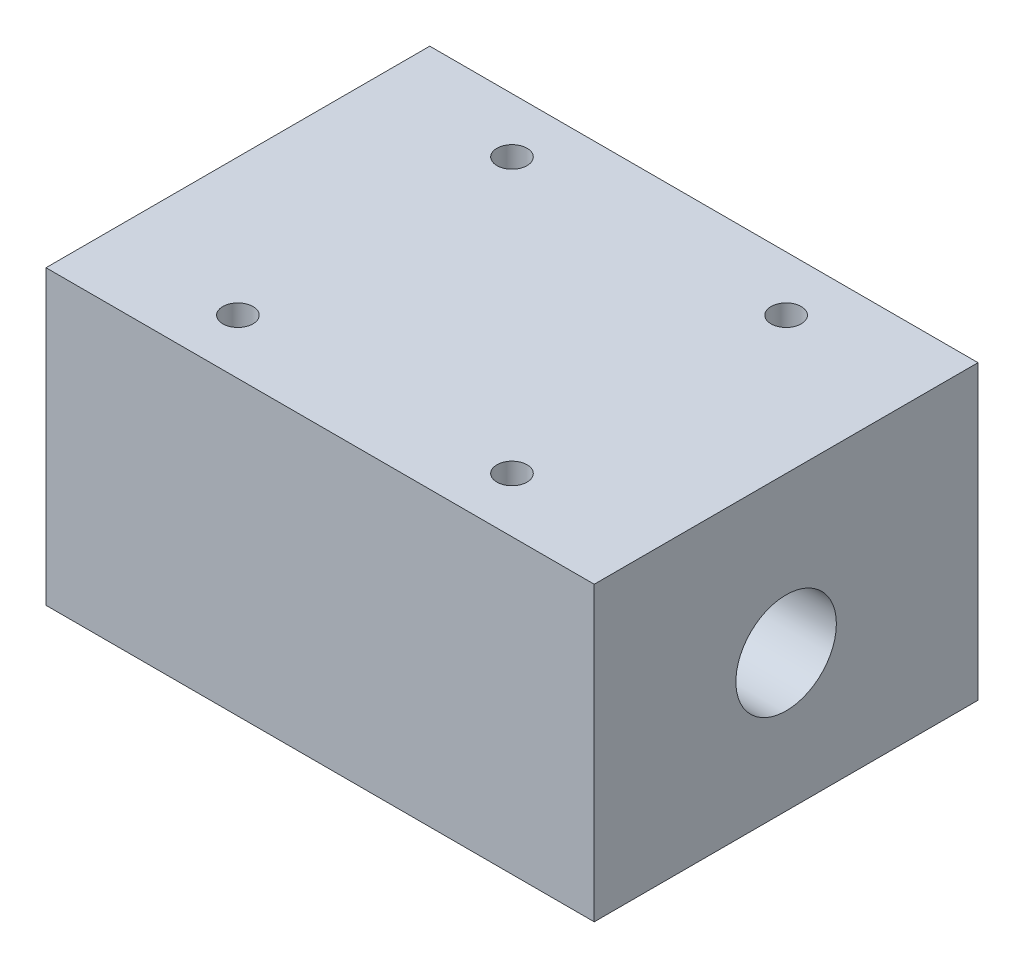
from build123d import *

# Parameters (mm, degrees)
SKETCH1_W                 = 60
SKETCH1_H                 = 42
BOSS_EXTRUDE1_DEPTH       = 32
M4X0_7_TAPPED_HOLE1_D     = 3.3
M4X0_7_TAPPED_HOLE1_DEPTH = 15
M4X0_7_TAPPED_HOLE1_TIP   = 0.991420021
SKETCH4_R                 = 5.5
CUT_EXTRUDE1_DEPTH        = 72.168813395


with BuildPart() as part:
    # Sketch1 → Boss-Extrude1 (new body)
    with BuildSketch(Plane(origin=(0, 0, 0), x_dir=(1, 0, 0), z_dir=(0, 1, 0))):
        Rectangle(SKETCH1_W, SKETCH1_H)
    extrude(amount=BOSS_EXTRUDE1_DEPTH)

    # M4x0.7 Tapped Hole1
    with Locations(Plane(origin=(0, 32, 0), x_dir=(1, 0, 0), z_dir=(0, 1, 0))):
        with Locations((15, 15), (-15, 15), (-15, -15), (15, -15)):
            Hole(M4X0_7_TAPPED_HOLE1_D / 2, depth=M4X0_7_TAPPED_HOLE1_DEPTH)
            with Locations((0, 0, -(M4X0_7_TAPPED_HOLE1_DEPTH + M4X0_7_TAPPED_HOLE1_TIP / 2))):  # 118° drill point
                Cone(0, M4X0_7_TAPPED_HOLE1_D / 2, M4X0_7_TAPPED_HOLE1_TIP, mode=Mode.SUBTRACT)

    # Sketch4 → Cut-Extrude1 (cut, through all)
    with BuildSketch(Plane(origin=(30, 0, 0), x_dir=(0, 0, -1), z_dir=(1, 0, 0))):
        with Locations((0, 15)):
            Circle(SKETCH4_R)
    extrude(amount=-CUT_EXTRUDE1_DEPTH, mode=Mode.SUBTRACT)


solid = part.part
